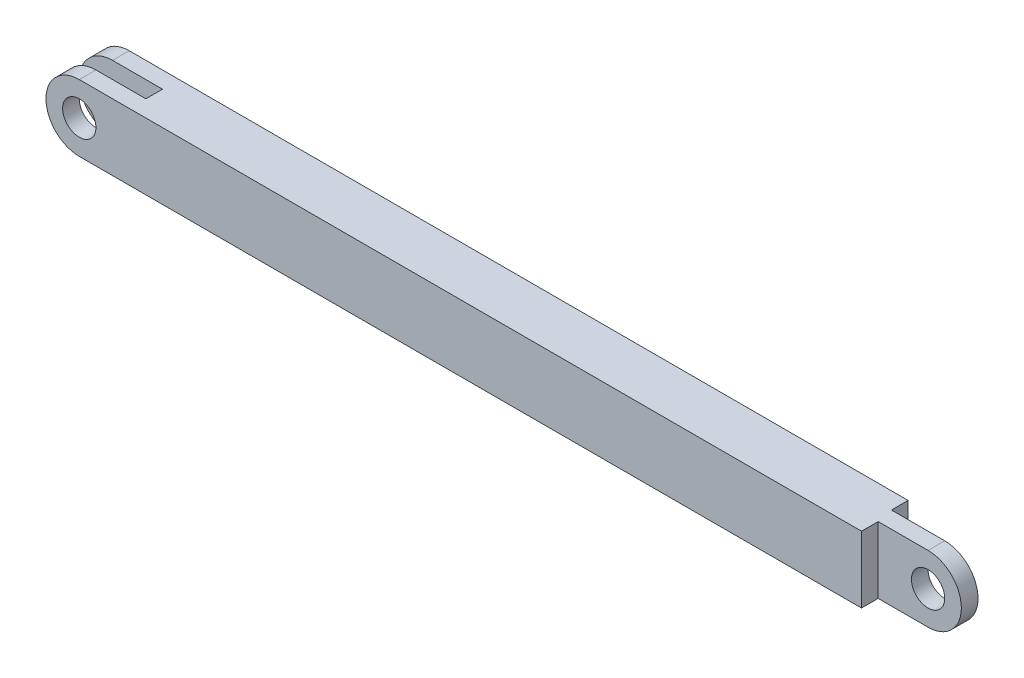
from build123d import *

# Parameters (mm, degrees)
SKETCH1_R           = 10
BOSS_EXTRUDE1_DEPTH = 30
SKETCH4_W           = 69.930145124
SKETCH4_H           = 10
CUT_EXTRUDE1_DEPTH  = 523.398315464


with BuildPart() as part:
    # Sketch1 → Boss-Extrude1 (new body)
    with BuildSketch(Plane.XY):
        with BuildLine():
            Line((0, 20), (500, 20))
            ThreePointArc((500, 20), (520, 0), (500, -20))
            Line((500, -20), (0, -20))
            ThreePointArc((0, -20), (-20, 0), (0, 20))
        make_face()
        Circle(SKETCH1_R, mode=Mode.SUBTRACT)
        with Locations((500, 0)):
            Circle(SKETCH1_R, mode=Mode.SUBTRACT)
    extrude(amount=BOSS_EXTRUDE1_DEPTH)

    # Sketch4 → Cut-Extrude1 (cut, through all)
    with BuildSketch(Plane.XZ.offset(20)):
        with Locations((-4.965072562, 15)):
            Rectangle(SKETCH4_W, SKETCH4_H)
        Polygon((470, 47.162996114), (470, 20), (535.290811534, 20), (535.290811534, 10), (467.990842664, 10), (467.990842664, -15.795499521), (553.153388579, -15.795499521), (553.153388579, 47.162996114), align=None)
    extrude(amount=-CUT_EXTRUDE1_DEPTH, mode=Mode.SUBTRACT)


solid = part.part
